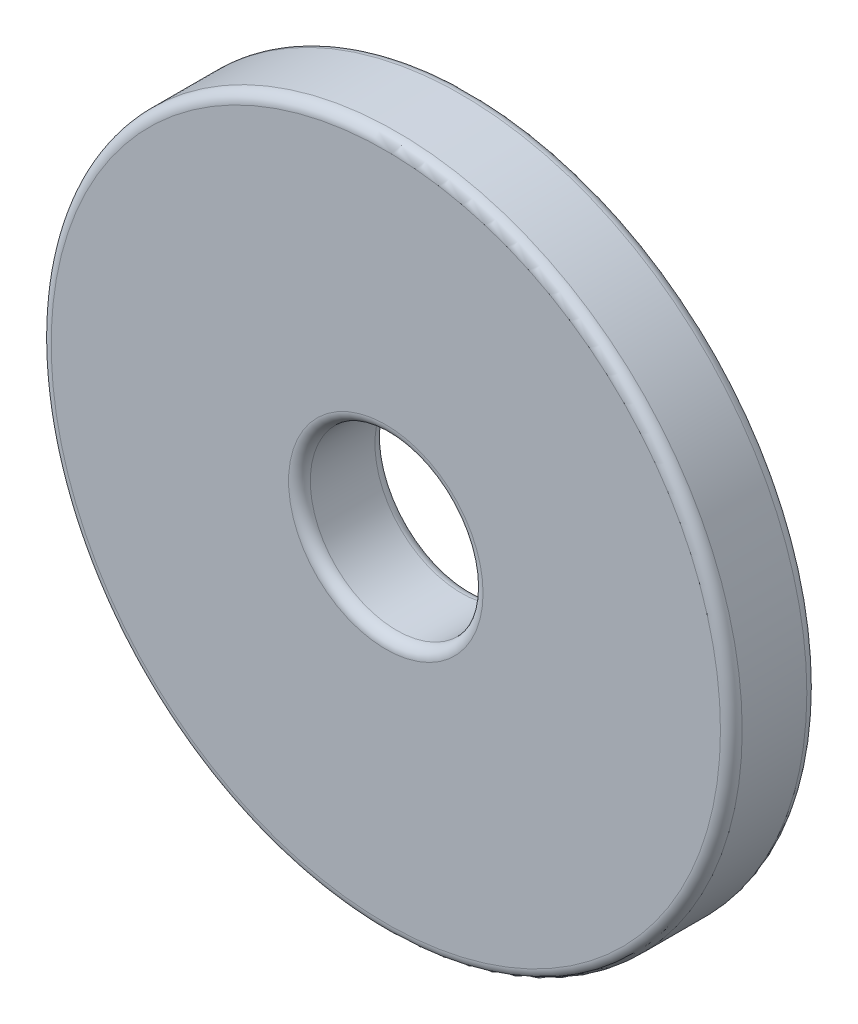
from build123d import *

# Parameters (mm, degrees)
SKETCH1_R           = 6.35
BOSS_EXTRUDE1_DEPTH = 1.5875
SKETCH2_R           = 1.5875
CUT_EXTRUDE1_DEPTH  = 76.374385622
FILLET1_R           = 0.2


with BuildPart() as part:
    # Sketch1 → Boss-Extrude1 (new body)
    with BuildSketch(Plane.XY):
        with Locations((68.398246491, 3.214386977)):
            Circle(SKETCH1_R)
    extrude(amount=BOSS_EXTRUDE1_DEPTH)

    # Sketch2 → Cut-Extrude1 (cut, through all)
    with BuildSketch(Plane(origin=(0, 0, 0), x_dir=(-1, 0, 0), z_dir=(0, 0, -1))):
        with Locations((-68.398246491, 3.214386977)):
            Circle(SKETCH2_R)
    extrude(amount=-CUT_EXTRUDE1_DEPTH, mode=Mode.SUBTRACT)

    # Fillet1
    fillet1_edges = [part.edges().sort_by_distance(p)[0] for p in [
        (62.048246491, 3.214386977, 0),
        (62.048246491, 3.214386977, 1.5875),
        (69.985746491, 3.214386977, 1.5875),
        (69.985746491, 3.214386977, 0),
    ]]
    fillet(fillet1_edges, radius=FILLET1_R)


solid = part.part
